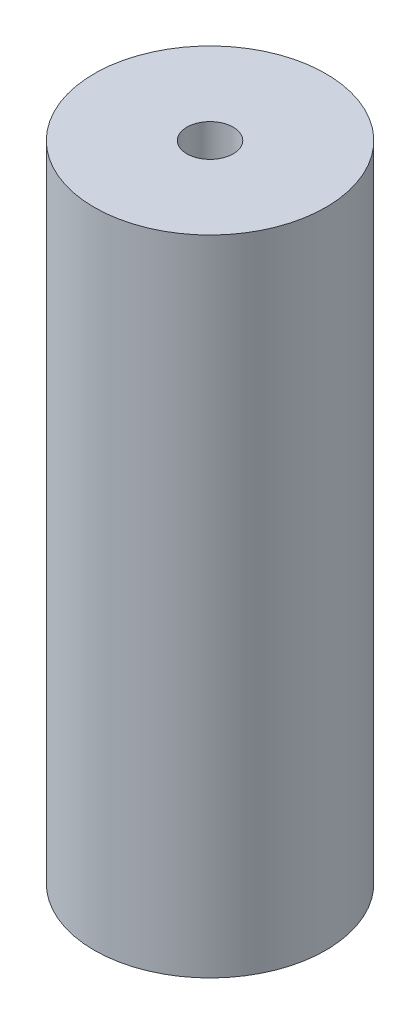
from build123d import *

# Parameters (mm, degrees)
SKETCH1_R           = 4.5
SKETCH1_R_2         = 2.05
BOSS_EXTRUDE1_DEPTH = 10
SKETCH3_R           = 4.5
SKETCH3_R_2         = 0.9
BOSS_EXTRUDE3_DEPTH = 15


with BuildPart() as part:
    # Sketch1 → Boss-Extrude1 (new body)
    with BuildSketch(Plane(origin=(0, 0, 0), x_dir=(1, 0, 0), z_dir=(0, 1, 0))):
        with Locations(Location((0, 0, 0), (0, 0, 270))):
            Circle(SKETCH1_R)
        with Locations(Location((0, 0, 0), (0, 0, 270))):
            Circle(SKETCH1_R_2, mode=Mode.SUBTRACT)
    extrude(amount=BOSS_EXTRUDE1_DEPTH)

    # Sketch3 → Boss-Extrude3 (add)
    with BuildSketch(Plane(origin=(0, 10, 0), x_dir=(1, 0, 0), z_dir=(0, 1, 0))):
        with Locations(Location((0, 0, 0), (0, 0, 270))):
            Circle(SKETCH3_R)
        with Locations(Location((0, 0, 0), (0, 0, 270))):
            Circle(SKETCH3_R_2, mode=Mode.SUBTRACT)
    extrude(amount=BOSS_EXTRUDE3_DEPTH)


solid = part.part
